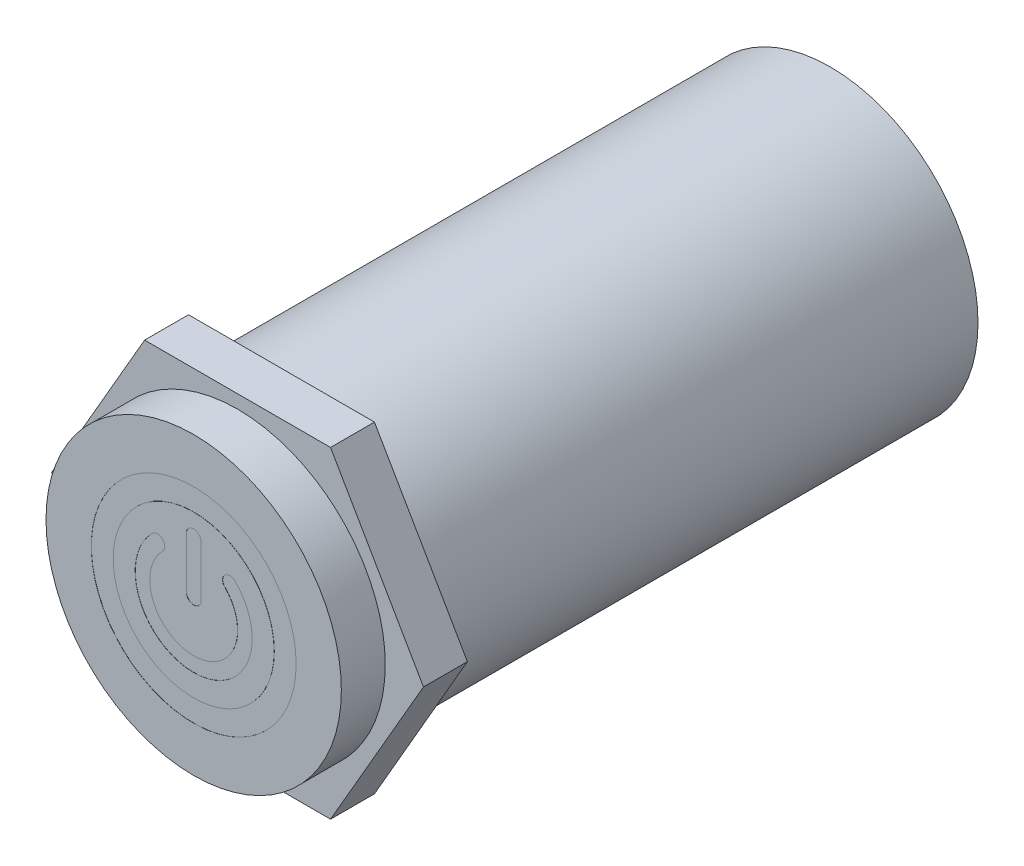
from build123d import *

# Parameters (mm, degrees)
EXTRUDE_1_DEPTH      = 3
EXTRUDE_2_DEPTH      = 3
EXTRUDE_2_DEPTH_BACK = 40.5
SKETCH_3_R           = 10.09
SKETCH_5_R           = 7
SKETCH_5_R_2         = 5.5
CUT_EXTRUDE_1_DEPTH  = 0.01


with BuildPart() as part:
    # 草图1 → 凸台-拉伸1 (new body)
    with BuildSketch(Plane.XY):
        Polygon((12.701705922, 0), (6.350852961, 11), (-6.350852961, 11), (-12.701705922, 0), (-6.350852961, -11), (6.350852961, -11), align=None)
    extrude(amount=EXTRUDE_1_DEPTH)

    # 草图3 → 凸台-拉伸2 (add, two sides: drawn at the far end of the back side and taken through both)
    with BuildSketch(Plane.XY.offset(3).offset(-EXTRUDE_2_DEPTH_BACK)):
        Circle(SKETCH_3_R)
    extrude(amount=EXTRUDE_2_DEPTH + EXTRUDE_2_DEPTH_BACK)

    # 草图5 → 切除-拉伸1 (cut)
    # profile 1 of 3: a face of its own
    with BuildSketch(Plane.XY.offset(6)):
        Circle(SKETCH_5_R)
        Circle(SKETCH_5_R_2, mode=Mode.SUBTRACT)
    # profile 2 of 3: a face of its own
    with BuildSketch(Plane.XY.offset(6)):
        with BuildLine():
            ThreePointArc((-2.828427125, 2.828427125), (-2.121320344, 2.828427125), (-2.121320344, 2.121320344))
            ThreePointArc((-2.121320344, 2.121320344), (0, -3), (2.121320344, 2.121320344))
            ThreePointArc((2.121320344, 2.121320344), (2.121320344, 2.828427125), (2.828427125, 2.828427125))
            ThreePointArc((2.828427125, 2.828427125), (0, -4), (-2.828427125, 2.828427125))
        make_face()
    # profile 3 of 3: a face of its own
    with BuildSketch(Plane.XY.offset(6)):
        with BuildLine():
            Line((-0.5, 0.5), (-0.5, 4))
            ThreePointArc((-0.5, 4), (0, 4.5), (0.5, 4))
            Line((0.5, 4), (0.5, 0.5))
            ThreePointArc((0.5, 0.5), (0, 0), (-0.5, 0.5))
        make_face()
    extrude(amount=-CUT_EXTRUDE_1_DEPTH, mode=Mode.SUBTRACT)


solid = part.part
